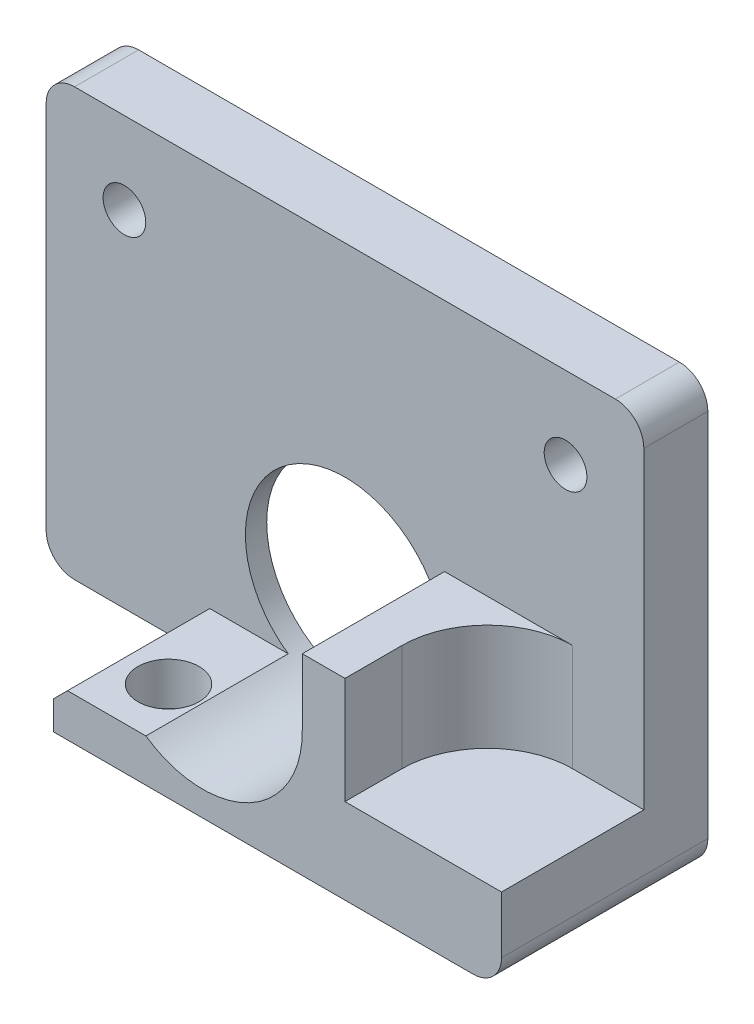
from build123d import *

# Parameters (mm, degrees)
SKETCH1_W               = 42
SKETCH1_H               = 30
BOSS_EXTRUDE1_DEPTH     = 4.5
BOSS_EXTRUDE2_DEPTH     = 10
FILLET1_R               = 6
SKETCH3_R               = 11.25
CUT_EXTRUDE1_DEPTH      = 3
CUT_EXTRUDE2_DEPTH      = 29.253318389
CUT_EXTRUDE2_DEPTH_BACK = 29.253318389
SKETCH4_R               = 7
FILLET2_R               = 2
CHAMFER1_SIZE           = 1
SKETCH6_R               = 2.15
CUT_EXTRUDE4_DEPTH      = 40.385911187
SKETCH7_R               = 1.5
CUT_EXTRUDE5_DEPTH      = 10


with BuildPart() as part:
    # Sketch1 → Boss-Extrude1 (new body)
    with BuildSketch(Plane.XY):
        Rectangle(SKETCH1_W, SKETCH1_H)
    extrude(amount=BOSS_EXTRUDE1_DEPTH)

    # Sketch2 → Boss-Extrude2 (add)
    with BuildSketch(Plane.XY.offset(4.5)):
        Polygon((21, -9), (10, -9), (10, -1.5), (7, -1.5), (7, -12), (-10.5, -12), (-10.5, -15), (21, -15), align=None)
    extrude(amount=BOSS_EXTRUDE2_DEPTH)

    # Fillet1
    fillet1_edges = [part.edges().sort_by_distance(p)[0] for p in [
        (10, -5.25, 4.5),
        (7, -12, 9.5),
    ]]
    fillet(fillet1_edges, radius=FILLET1_R)

    # Sketch3 → Cut-Extrude1 (cut)
    with BuildSketch(Plane(origin=(0, 0, 0), x_dir=(-1, 0, 0), z_dir=(0, 0, -1))):
        with Locations((0, -6.25)):
            Circle(SKETCH3_R)
    extrude(amount=-CUT_EXTRUDE1_DEPTH, mode=Mode.SUBTRACT)

    # Sketch4 → Cut-Extrude2 (cut, two sides: drawn at the far end of the back side and taken through both)
    with BuildSketch(Plane(origin=(0, 0, 3), x_dir=(-1, 0, 0), z_dir=(0, 0, -1)).offset(-CUT_EXTRUDE2_DEPTH_BACK)):
        with Locations((0, -6.25)):
            Circle(SKETCH4_R)
    extrude(amount=CUT_EXTRUDE2_DEPTH + CUT_EXTRUDE2_DEPTH_BACK, mode=Mode.SUBTRACT)

    # Fillet2
    fillet2_edges = [part.edges().sort_by_distance(p)[0] for p in [
        (21, -15, 7.25),
        (-21, -15, 2.25),
        (-21, 15, 2.25),
        (21, 15, 2.25),
    ]]
    fillet(fillet2_edges, radius=FILLET2_R)

    # Chamfer1
    chamfer1_edges = [part.edges().sort_by_distance(p)[0] for p in [
        (-10.5, -12, 9.5),
    ]]
    chamfer(chamfer1_edges, length=CHAMFER1_SIZE)

    # Sketch6 → Cut-Extrude4 (cut, through all)
    with BuildSketch(Plane.XZ.offset(15)):
        with Locations(Location((-6.35, 10.55, 0), (0, 0, 270))):
            Circle(SKETCH6_R)
    extrude(amount=-CUT_EXTRUDE4_DEPTH, mode=Mode.SUBTRACT)

    # Sketch7 → Cut-Extrude5 (cut)
    with BuildSketch(Plane.XY.offset(4.5)):
        with Locations((-15.5, 9.25)):
            Circle(SKETCH7_R)
        with Locations((15.5, 9.25)):
            Circle(SKETCH7_R)
    extrude(amount=-CUT_EXTRUDE5_DEPTH, mode=Mode.SUBTRACT)


solid = part.part
